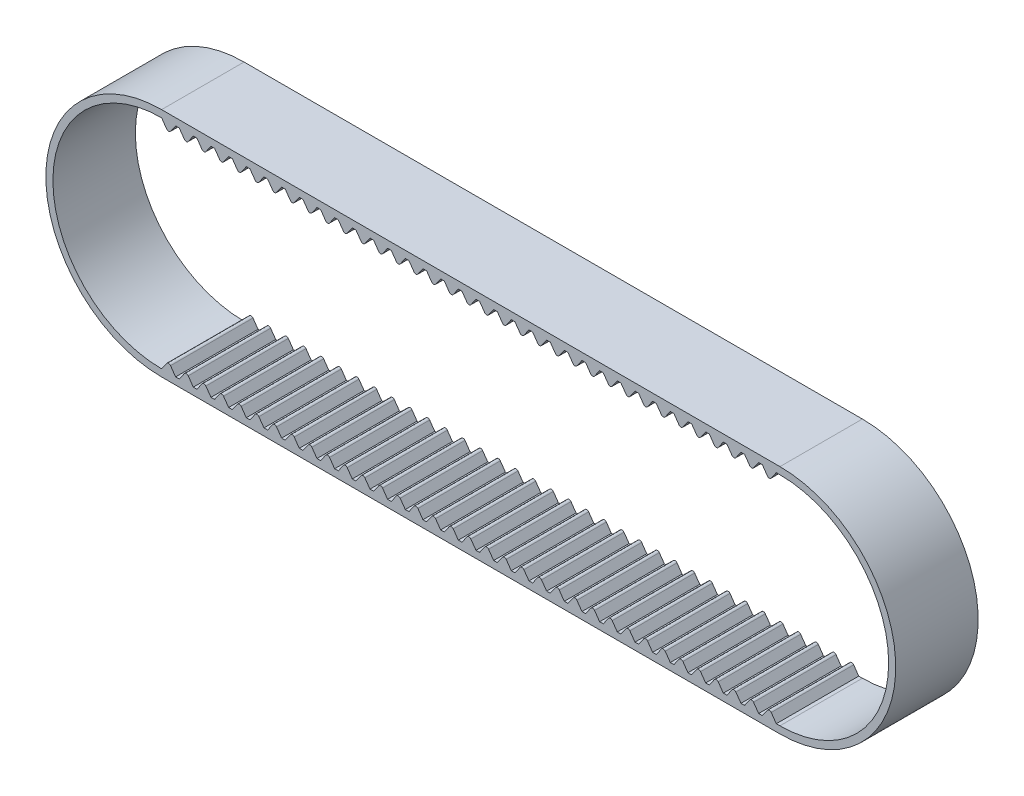
from build123d import *

# Parameters (mm, degrees)
LINEAR_AUSTRAGEN_D_NN1_DEPTH    = 3.5
AUFSATZ_LINEAR_AUSTRAGEN1_DEPTH = 7
LINEARES_MUSTER1_COUNT          = 35
LINEARES_MUSTER1_PITCH          = 1.5
SPIEGELN1_COPY_1_DEPTH          = 7
SPIEGELN1_COPY_2_DEPTH          = 7
SPIEGELN1_COPY_3_DEPTH          = 7
SPIEGELN1_COPY_4_DEPTH          = 7
SPIEGELN1_COPY_5_DEPTH          = 7
SPIEGELN1_COPY_6_DEPTH          = 7
SPIEGELN1_COPY_7_DEPTH          = 7
SPIEGELN1_COPY_8_DEPTH          = 7
SPIEGELN1_COPY_9_DEPTH          = 7
SPIEGELN1_COPY_10_DEPTH         = 7
SPIEGELN1_COPY_11_DEPTH         = 7
SPIEGELN1_COPY_12_DEPTH         = 7
SPIEGELN1_COPY_13_DEPTH         = 7
SPIEGELN1_COPY_14_DEPTH         = 7
SPIEGELN1_COPY_15_DEPTH         = 7
SPIEGELN1_COPY_16_DEPTH         = 7
SPIEGELN1_COPY_17_DEPTH         = 7
SPIEGELN1_COPY_18_DEPTH         = 7
SPIEGELN1_COPY_19_DEPTH         = 7
SPIEGELN1_COPY_20_DEPTH         = 7
SPIEGELN1_COPY_21_DEPTH         = 7
SPIEGELN1_COPY_22_DEPTH         = 7
SPIEGELN1_COPY_23_DEPTH         = 7
SPIEGELN1_COPY_24_DEPTH         = 7
SPIEGELN1_COPY_25_DEPTH         = 7
SPIEGELN1_COPY_26_DEPTH         = 7
SPIEGELN1_COPY_27_DEPTH         = 7
SPIEGELN1_COPY_28_DEPTH         = 7
SPIEGELN1_COPY_29_DEPTH         = 7
SPIEGELN1_COPY_30_DEPTH         = 7
SPIEGELN1_COPY_31_DEPTH         = 7
SPIEGELN1_COPY_32_DEPTH         = 7
SPIEGELN1_COPY_33_DEPTH         = 7
SPIEGELN1_COPY_34_DEPTH         = 7


with BuildPart() as part:
    # Skizze1 → Linear-Austragen-Dünn1 (new, symmetric)
    with BuildSketch(Plane.XY):
        with BuildLine():
            Line((-26.25, 9.83), (26.25, 9.83))
            ThreePointArc((26.25, 9.83), (36.08, 0), (26.25, -9.83))
            Line((26.25, -9.83), (-26.25, -9.83))
            ThreePointArc((-26.25, -9.83), (-36.08, 0), (-26.25, 9.83))
        make_face()
        with BuildLine():
            Line((-26.25, 9.23), (26.25, 9.23))
            ThreePointArc((26.25, 9.23), (35.48, 0), (26.25, -9.23))
            Line((26.25, -9.23), (-26.25, -9.23))
            ThreePointArc((-26.25, -9.23), (-35.48, 0), (-26.25, 9.23))
        make_face(mode=Mode.SUBTRACT)
    extrude(amount=LINEAR_AUSTRAGEN_D_NN1_DEPTH, both=True)

    # Skizze2 → Aufsatz-Linear austragen1 (add)
    with BuildSketch(Plane.XY.offset(3.5)):
        with BuildLine():
            Line((-26.25, 9.23), (-25.81873759, 8.615152268))
            ThreePointArc((-25.81873759, 8.615152268), (-25.655, 8.53), (-25.49126241, 8.615152268))
            Line((-25.49126241, 8.615152268), (-25.06, 9.23))
            Line((-25.06, 9.23), (-26.25, 9.23))
        make_face()
    aufsatz_linear_austragen1 = extrude(amount=-AUFSATZ_LINEAR_AUSTRAGEN1_DEPTH)

    # Lineares Muster1: Aufsatz-Linear austragen1 ×35
    with Locations(*[(i * LINEARES_MUSTER1_PITCH, 0, 0) for i in range(1, LINEARES_MUSTER1_COUNT)]):
        add(aufsatz_linear_austragen1)

    # Spiegeln1: Aufsatz-Linear austragen1 across plane
    add(aufsatz_linear_austragen1.mirror(Plane.ZX))

    # Spiegeln1 copy 1 sketch → Spiegeln1 copy 1 (add)
    with BuildSketch(Plane(origin=(1.5, 0, 3.5), x_dir=(1, 0, 0), z_dir=(0, 0, 1))):
        with BuildLine():
            Line((-26.25, -9.23), (-25.81873759, -8.615152268))
            ThreePointArc((-25.81873759, -8.615152268), (-25.655, -8.53), (-25.49126241, -8.615152268))
            Line((-25.49126241, -8.615152268), (-25.06, -9.23))
            Line((-25.06, -9.23), (-26.25, -9.23))
        make_face()
    extrude(amount=-SPIEGELN1_COPY_1_DEPTH)

    # Spiegeln1 copy 2 sketch → Spiegeln1 copy 2 (add)
    with BuildSketch(Plane(origin=(3, 0, 3.5), x_dir=(1, 0, 0), z_dir=(0, 0, 1))):
        with BuildLine():
            Line((-26.25, -9.23), (-25.81873759, -8.615152268))
            ThreePointArc((-25.81873759, -8.615152268), (-25.655, -8.53), (-25.49126241, -8.615152268))
            Line((-25.49126241, -8.615152268), (-25.06, -9.23))
            Line((-25.06, -9.23), (-26.25, -9.23))
        make_face()
    extrude(amount=-SPIEGELN1_COPY_2_DEPTH)

    # Spiegeln1 copy 3 sketch → Spiegeln1 copy 3 (add)
    with BuildSketch(Plane(origin=(4.5, 0, 3.5), x_dir=(1, 0, 0), z_dir=(0, 0, 1))):
        with BuildLine():
            Line((-26.25, -9.23), (-25.81873759, -8.615152268))
            ThreePointArc((-25.81873759, -8.615152268), (-25.655, -8.53), (-25.49126241, -8.615152268))
            Line((-25.49126241, -8.615152268), (-25.06, -9.23))
            Line((-25.06, -9.23), (-26.25, -9.23))
        make_face()
    extrude(amount=-SPIEGELN1_COPY_3_DEPTH)

    # Spiegeln1 copy 4 sketch → Spiegeln1 copy 4 (add)
    with BuildSketch(Plane(origin=(6, 0, 3.5), x_dir=(1, 0, 0), z_dir=(0, 0, 1))):
        with BuildLine():
            Line((-26.25, -9.23), (-25.81873759, -8.615152268))
            ThreePointArc((-25.81873759, -8.615152268), (-25.655, -8.53), (-25.49126241, -8.615152268))
            Line((-25.49126241, -8.615152268), (-25.06, -9.23))
            Line((-25.06, -9.23), (-26.25, -9.23))
        make_face()
    extrude(amount=-SPIEGELN1_COPY_4_DEPTH)

    # Spiegeln1 copy 5 sketch → Spiegeln1 copy 5 (add)
    with BuildSketch(Plane(origin=(7.5, 0, 3.5), x_dir=(1, 0, 0), z_dir=(0, 0, 1))):
        with BuildLine():
            Line((-26.25, -9.23), (-25.81873759, -8.615152268))
            ThreePointArc((-25.81873759, -8.615152268), (-25.655, -8.53), (-25.49126241, -8.615152268))
            Line((-25.49126241, -8.615152268), (-25.06, -9.23))
            Line((-25.06, -9.23), (-26.25, -9.23))
        make_face()
    extrude(amount=-SPIEGELN1_COPY_5_DEPTH)

    # Spiegeln1 copy 6 sketch → Spiegeln1 copy 6 (add)
    with BuildSketch(Plane(origin=(9, 0, 3.5), x_dir=(1, 0, 0), z_dir=(0, 0, 1))):
        with BuildLine():
            Line((-26.25, -9.23), (-25.81873759, -8.615152268))
            ThreePointArc((-25.81873759, -8.615152268), (-25.655, -8.53), (-25.49126241, -8.615152268))
            Line((-25.49126241, -8.615152268), (-25.06, -9.23))
            Line((-25.06, -9.23), (-26.25, -9.23))
        make_face()
    extrude(amount=-SPIEGELN1_COPY_6_DEPTH)

    # Spiegeln1 copy 7 sketch → Spiegeln1 copy 7 (add)
    with BuildSketch(Plane(origin=(10.5, 0, 3.5), x_dir=(1, 0, 0), z_dir=(0, 0, 1))):
        with BuildLine():
            Line((-26.25, -9.23), (-25.81873759, -8.615152268))
            ThreePointArc((-25.81873759, -8.615152268), (-25.655, -8.53), (-25.49126241, -8.615152268))
            Line((-25.49126241, -8.615152268), (-25.06, -9.23))
            Line((-25.06, -9.23), (-26.25, -9.23))
        make_face()
    extrude(amount=-SPIEGELN1_COPY_7_DEPTH)

    # Spiegeln1 copy 8 sketch → Spiegeln1 copy 8 (add)
    with BuildSketch(Plane(origin=(12, 0, 3.5), x_dir=(1, 0, 0), z_dir=(0, 0, 1))):
        with BuildLine():
            Line((-26.25, -9.23), (-25.81873759, -8.615152268))
            ThreePointArc((-25.81873759, -8.615152268), (-25.655, -8.53), (-25.49126241, -8.615152268))
            Line((-25.49126241, -8.615152268), (-25.06, -9.23))
            Line((-25.06, -9.23), (-26.25, -9.23))
        make_face()
    extrude(amount=-SPIEGELN1_COPY_8_DEPTH)

    # Spiegeln1 copy 9 sketch → Spiegeln1 copy 9 (add)
    with BuildSketch(Plane(origin=(13.5, 0, 3.5), x_dir=(1, 0, 0), z_dir=(0, 0, 1))):
        with BuildLine():
            Line((-26.25, -9.23), (-25.81873759, -8.615152268))
            ThreePointArc((-25.81873759, -8.615152268), (-25.655, -8.53), (-25.49126241, -8.615152268))
            Line((-25.49126241, -8.615152268), (-25.06, -9.23))
            Line((-25.06, -9.23), (-26.25, -9.23))
        make_face()
    extrude(amount=-SPIEGELN1_COPY_9_DEPTH)

    # Spiegeln1 copy 10 sketch → Spiegeln1 copy 10 (add)
    with BuildSketch(Plane(origin=(15, 0, 3.5), x_dir=(1, 0, 0), z_dir=(0, 0, 1))):
        with BuildLine():
            Line((-26.25, -9.23), (-25.81873759, -8.615152268))
            ThreePointArc((-25.81873759, -8.615152268), (-25.655, -8.53), (-25.49126241, -8.615152268))
            Line((-25.49126241, -8.615152268), (-25.06, -9.23))
            Line((-25.06, -9.23), (-26.25, -9.23))
        make_face()
    extrude(amount=-SPIEGELN1_COPY_10_DEPTH)

    # Spiegeln1 copy 11 sketch → Spiegeln1 copy 11 (add)
    with BuildSketch(Plane(origin=(16.5, 0, 3.5), x_dir=(1, 0, 0), z_dir=(0, 0, 1))):
        with BuildLine():
            Line((-26.25, -9.23), (-25.81873759, -8.615152268))
            ThreePointArc((-25.81873759, -8.615152268), (-25.655, -8.53), (-25.49126241, -8.615152268))
            Line((-25.49126241, -8.615152268), (-25.06, -9.23))
            Line((-25.06, -9.23), (-26.25, -9.23))
        make_face()
    extrude(amount=-SPIEGELN1_COPY_11_DEPTH)

    # Spiegeln1 copy 12 sketch → Spiegeln1 copy 12 (add)
    with BuildSketch(Plane(origin=(18, 0, 3.5), x_dir=(1, 0, 0), z_dir=(0, 0, 1))):
        with BuildLine():
            Line((-26.25, -9.23), (-25.81873759, -8.615152268))
            ThreePointArc((-25.81873759, -8.615152268), (-25.655, -8.53), (-25.49126241, -8.615152268))
            Line((-25.49126241, -8.615152268), (-25.06, -9.23))
            Line((-25.06, -9.23), (-26.25, -9.23))
        make_face()
    extrude(amount=-SPIEGELN1_COPY_12_DEPTH)

    # Spiegeln1 copy 13 sketch → Spiegeln1 copy 13 (add)
    with BuildSketch(Plane(origin=(19.5, 0, 3.5), x_dir=(1, 0, 0), z_dir=(0, 0, 1))):
        with BuildLine():
            Line((-26.25, -9.23), (-25.81873759, -8.615152268))
            ThreePointArc((-25.81873759, -8.615152268), (-25.655, -8.53), (-25.49126241, -8.615152268))
            Line((-25.49126241, -8.615152268), (-25.06, -9.23))
            Line((-25.06, -9.23), (-26.25, -9.23))
        make_face()
    extrude(amount=-SPIEGELN1_COPY_13_DEPTH)

    # Spiegeln1 copy 14 sketch → Spiegeln1 copy 14 (add)
    with BuildSketch(Plane(origin=(21, 0, 3.5), x_dir=(1, 0, 0), z_dir=(0, 0, 1))):
        with BuildLine():
            Line((-26.25, -9.23), (-25.81873759, -8.615152268))
            ThreePointArc((-25.81873759, -8.615152268), (-25.655, -8.53), (-25.49126241, -8.615152268))
            Line((-25.49126241, -8.615152268), (-25.06, -9.23))
            Line((-25.06, -9.23), (-26.25, -9.23))
        make_face()
    extrude(amount=-SPIEGELN1_COPY_14_DEPTH)

    # Spiegeln1 copy 15 sketch → Spiegeln1 copy 15 (add)
    with BuildSketch(Plane(origin=(22.5, 0, 3.5), x_dir=(1, 0, 0), z_dir=(0, 0, 1))):
        with BuildLine():
            Line((-26.25, -9.23), (-25.81873759, -8.615152268))
            ThreePointArc((-25.81873759, -8.615152268), (-25.655, -8.53), (-25.49126241, -8.615152268))
            Line((-25.49126241, -8.615152268), (-25.06, -9.23))
            Line((-25.06, -9.23), (-26.25, -9.23))
        make_face()
    extrude(amount=-SPIEGELN1_COPY_15_DEPTH)

    # Spiegeln1 copy 16 sketch → Spiegeln1 copy 16 (add)
    with BuildSketch(Plane(origin=(24, 0, 3.5), x_dir=(1, 0, 0), z_dir=(0, 0, 1))):
        with BuildLine():
            Line((-26.25, -9.23), (-25.81873759, -8.615152268))
            ThreePointArc((-25.81873759, -8.615152268), (-25.655, -8.53), (-25.49126241, -8.615152268))
            Line((-25.49126241, -8.615152268), (-25.06, -9.23))
            Line((-25.06, -9.23), (-26.25, -9.23))
        make_face()
    extrude(amount=-SPIEGELN1_COPY_16_DEPTH)

    # Spiegeln1 copy 17 sketch → Spiegeln1 copy 17 (add)
    with BuildSketch(Plane(origin=(25.5, 0, 3.5), x_dir=(1, 0, 0), z_dir=(0, 0, 1))):
        with BuildLine():
            Line((-26.25, -9.23), (-25.81873759, -8.615152268))
            ThreePointArc((-25.81873759, -8.615152268), (-25.655, -8.53), (-25.49126241, -8.615152268))
            Line((-25.49126241, -8.615152268), (-25.06, -9.23))
            Line((-25.06, -9.23), (-26.25, -9.23))
        make_face()
    extrude(amount=-SPIEGELN1_COPY_17_DEPTH)

    # Spiegeln1 copy 18 sketch → Spiegeln1 copy 18 (add)
    with BuildSketch(Plane(origin=(27, 0, 3.5), x_dir=(1, 0, 0), z_dir=(0, 0, 1))):
        with BuildLine():
            Line((-26.25, -9.23), (-25.81873759, -8.615152268))
            ThreePointArc((-25.81873759, -8.615152268), (-25.655, -8.53), (-25.49126241, -8.615152268))
            Line((-25.49126241, -8.615152268), (-25.06, -9.23))
            Line((-25.06, -9.23), (-26.25, -9.23))
        make_face()
    extrude(amount=-SPIEGELN1_COPY_18_DEPTH)

    # Spiegeln1 copy 19 sketch → Spiegeln1 copy 19 (add)
    with BuildSketch(Plane(origin=(28.5, 0, 3.5), x_dir=(1, 0, 0), z_dir=(0, 0, 1))):
        with BuildLine():
            Line((-26.25, -9.23), (-25.81873759, -8.615152268))
            ThreePointArc((-25.81873759, -8.615152268), (-25.655, -8.53), (-25.49126241, -8.615152268))
            Line((-25.49126241, -8.615152268), (-25.06, -9.23))
            Line((-25.06, -9.23), (-26.25, -9.23))
        make_face()
    extrude(amount=-SPIEGELN1_COPY_19_DEPTH)

    # Spiegeln1 copy 20 sketch → Spiegeln1 copy 20 (add)
    with BuildSketch(Plane(origin=(30, 0, 3.5), x_dir=(1, 0, 0), z_dir=(0, 0, 1))):
        with BuildLine():
            Line((-26.25, -9.23), (-25.81873759, -8.615152268))
            ThreePointArc((-25.81873759, -8.615152268), (-25.655, -8.53), (-25.49126241, -8.615152268))
            Line((-25.49126241, -8.615152268), (-25.06, -9.23))
            Line((-25.06, -9.23), (-26.25, -9.23))
        make_face()
    extrude(amount=-SPIEGELN1_COPY_20_DEPTH)

    # Spiegeln1 copy 21 sketch → Spiegeln1 copy 21 (add)
    with BuildSketch(Plane(origin=(31.5, 0, 3.5), x_dir=(1, 0, 0), z_dir=(0, 0, 1))):
        with BuildLine():
            Line((-26.25, -9.23), (-25.81873759, -8.615152268))
            ThreePointArc((-25.81873759, -8.615152268), (-25.655, -8.53), (-25.49126241, -8.615152268))
            Line((-25.49126241, -8.615152268), (-25.06, -9.23))
            Line((-25.06, -9.23), (-26.25, -9.23))
        make_face()
    extrude(amount=-SPIEGELN1_COPY_21_DEPTH)

    # Spiegeln1 copy 22 sketch → Spiegeln1 copy 22 (add)
    with BuildSketch(Plane(origin=(33, 0, 3.5), x_dir=(1, 0, 0), z_dir=(0, 0, 1))):
        with BuildLine():
            Line((-26.25, -9.23), (-25.81873759, -8.615152268))
            ThreePointArc((-25.81873759, -8.615152268), (-25.655, -8.53), (-25.49126241, -8.615152268))
            Line((-25.49126241, -8.615152268), (-25.06, -9.23))
            Line((-25.06, -9.23), (-26.25, -9.23))
        make_face()
    extrude(amount=-SPIEGELN1_COPY_22_DEPTH)

    # Spiegeln1 copy 23 sketch → Spiegeln1 copy 23 (add)
    with BuildSketch(Plane(origin=(34.5, 0, 3.5), x_dir=(1, 0, 0), z_dir=(0, 0, 1))):
        with BuildLine():
            Line((-26.25, -9.23), (-25.81873759, -8.615152268))
            ThreePointArc((-25.81873759, -8.615152268), (-25.655, -8.53), (-25.49126241, -8.615152268))
            Line((-25.49126241, -8.615152268), (-25.06, -9.23))
            Line((-25.06, -9.23), (-26.25, -9.23))
        make_face()
    extrude(amount=-SPIEGELN1_COPY_23_DEPTH)

    # Spiegeln1 copy 24 sketch → Spiegeln1 copy 24 (add)
    with BuildSketch(Plane(origin=(36, 0, 3.5), x_dir=(1, 0, 0), z_dir=(0, 0, 1))):
        with BuildLine():
            Line((-26.25, -9.23), (-25.81873759, -8.615152268))
            ThreePointArc((-25.81873759, -8.615152268), (-25.655, -8.53), (-25.49126241, -8.615152268))
            Line((-25.49126241, -8.615152268), (-25.06, -9.23))
            Line((-25.06, -9.23), (-26.25, -9.23))
        make_face()
    extrude(amount=-SPIEGELN1_COPY_24_DEPTH)

    # Spiegeln1 copy 25 sketch → Spiegeln1 copy 25 (add)
    with BuildSketch(Plane(origin=(37.5, 0, 3.5), x_dir=(1, 0, 0), z_dir=(0, 0, 1))):
        with BuildLine():
            Line((-26.25, -9.23), (-25.81873759, -8.615152268))
            ThreePointArc((-25.81873759, -8.615152268), (-25.655, -8.53), (-25.49126241, -8.615152268))
            Line((-25.49126241, -8.615152268), (-25.06, -9.23))
            Line((-25.06, -9.23), (-26.25, -9.23))
        make_face()
    extrude(amount=-SPIEGELN1_COPY_25_DEPTH)

    # Spiegeln1 copy 26 sketch → Spiegeln1 copy 26 (add)
    with BuildSketch(Plane(origin=(39, 0, 3.5), x_dir=(1, 0, 0), z_dir=(0, 0, 1))):
        with BuildLine():
            Line((-26.25, -9.23), (-25.81873759, -8.615152268))
            ThreePointArc((-25.81873759, -8.615152268), (-25.655, -8.53), (-25.49126241, -8.615152268))
            Line((-25.49126241, -8.615152268), (-25.06, -9.23))
            Line((-25.06, -9.23), (-26.25, -9.23))
        make_face()
    extrude(amount=-SPIEGELN1_COPY_26_DEPTH)

    # Spiegeln1 copy 27 sketch → Spiegeln1 copy 27 (add)
    with BuildSketch(Plane(origin=(40.5, 0, 3.5), x_dir=(1, 0, 0), z_dir=(0, 0, 1))):
        with BuildLine():
            Line((-26.25, -9.23), (-25.81873759, -8.615152268))
            ThreePointArc((-25.81873759, -8.615152268), (-25.655, -8.53), (-25.49126241, -8.615152268))
            Line((-25.49126241, -8.615152268), (-25.06, -9.23))
            Line((-25.06, -9.23), (-26.25, -9.23))
        make_face()
    extrude(amount=-SPIEGELN1_COPY_27_DEPTH)

    # Spiegeln1 copy 28 sketch → Spiegeln1 copy 28 (add)
    with BuildSketch(Plane(origin=(42, 0, 3.5), x_dir=(1, 0, 0), z_dir=(0, 0, 1))):
        with BuildLine():
            Line((-26.25, -9.23), (-25.81873759, -8.615152268))
            ThreePointArc((-25.81873759, -8.615152268), (-25.655, -8.53), (-25.49126241, -8.615152268))
            Line((-25.49126241, -8.615152268), (-25.06, -9.23))
            Line((-25.06, -9.23), (-26.25, -9.23))
        make_face()
    extrude(amount=-SPIEGELN1_COPY_28_DEPTH)

    # Spiegeln1 copy 29 sketch → Spiegeln1 copy 29 (add)
    with BuildSketch(Plane(origin=(43.5, 0, 3.5), x_dir=(1, 0, 0), z_dir=(0, 0, 1))):
        with BuildLine():
            Line((-26.25, -9.23), (-25.81873759, -8.615152268))
            ThreePointArc((-25.81873759, -8.615152268), (-25.655, -8.53), (-25.49126241, -8.615152268))
            Line((-25.49126241, -8.615152268), (-25.06, -9.23))
            Line((-25.06, -9.23), (-26.25, -9.23))
        make_face()
    extrude(amount=-SPIEGELN1_COPY_29_DEPTH)

    # Spiegeln1 copy 30 sketch → Spiegeln1 copy 30 (add)
    with BuildSketch(Plane(origin=(45, 0, 3.5), x_dir=(1, 0, 0), z_dir=(0, 0, 1))):
        with BuildLine():
            Line((-26.25, -9.23), (-25.81873759, -8.615152268))
            ThreePointArc((-25.81873759, -8.615152268), (-25.655, -8.53), (-25.49126241, -8.615152268))
            Line((-25.49126241, -8.615152268), (-25.06, -9.23))
            Line((-25.06, -9.23), (-26.25, -9.23))
        make_face()
    extrude(amount=-SPIEGELN1_COPY_30_DEPTH)

    # Spiegeln1 copy 31 sketch → Spiegeln1 copy 31 (add)
    with BuildSketch(Plane(origin=(46.5, 0, 3.5), x_dir=(1, 0, 0), z_dir=(0, 0, 1))):
        with BuildLine():
            Line((-26.25, -9.23), (-25.81873759, -8.615152268))
            ThreePointArc((-25.81873759, -8.615152268), (-25.655, -8.53), (-25.49126241, -8.615152268))
            Line((-25.49126241, -8.615152268), (-25.06, -9.23))
            Line((-25.06, -9.23), (-26.25, -9.23))
        make_face()
    extrude(amount=-SPIEGELN1_COPY_31_DEPTH)

    # Spiegeln1 copy 32 sketch → Spiegeln1 copy 32 (add)
    with BuildSketch(Plane(origin=(48, 0, 3.5), x_dir=(1, 0, 0), z_dir=(0, 0, 1))):
        with BuildLine():
            Line((-26.25, -9.23), (-25.81873759, -8.615152268))
            ThreePointArc((-25.81873759, -8.615152268), (-25.655, -8.53), (-25.49126241, -8.615152268))
            Line((-25.49126241, -8.615152268), (-25.06, -9.23))
            Line((-25.06, -9.23), (-26.25, -9.23))
        make_face()
    extrude(amount=-SPIEGELN1_COPY_32_DEPTH)

    # Spiegeln1 copy 33 sketch → Spiegeln1 copy 33 (add)
    with BuildSketch(Plane(origin=(49.5, 0, 3.5), x_dir=(1, 0, 0), z_dir=(0, 0, 1))):
        with BuildLine():
            Line((-26.25, -9.23), (-25.81873759, -8.615152268))
            ThreePointArc((-25.81873759, -8.615152268), (-25.655, -8.53), (-25.49126241, -8.615152268))
            Line((-25.49126241, -8.615152268), (-25.06, -9.23))
            Line((-25.06, -9.23), (-26.25, -9.23))
        make_face()
    extrude(amount=-SPIEGELN1_COPY_33_DEPTH)

    # Spiegeln1 copy 34 sketch → Spiegeln1 copy 34 (add)
    with BuildSketch(Plane(origin=(51, 0, 3.5), x_dir=(1, 0, 0), z_dir=(0, 0, 1))):
        with BuildLine():
            Line((-26.25, -9.23), (-25.81873759, -8.615152268))
            ThreePointArc((-25.81873759, -8.615152268), (-25.655, -8.53), (-25.49126241, -8.615152268))
            Line((-25.49126241, -8.615152268), (-25.06, -9.23))
            Line((-25.06, -9.23), (-26.25, -9.23))
        make_face()
    extrude(amount=-SPIEGELN1_COPY_34_DEPTH)


solid = part.part
